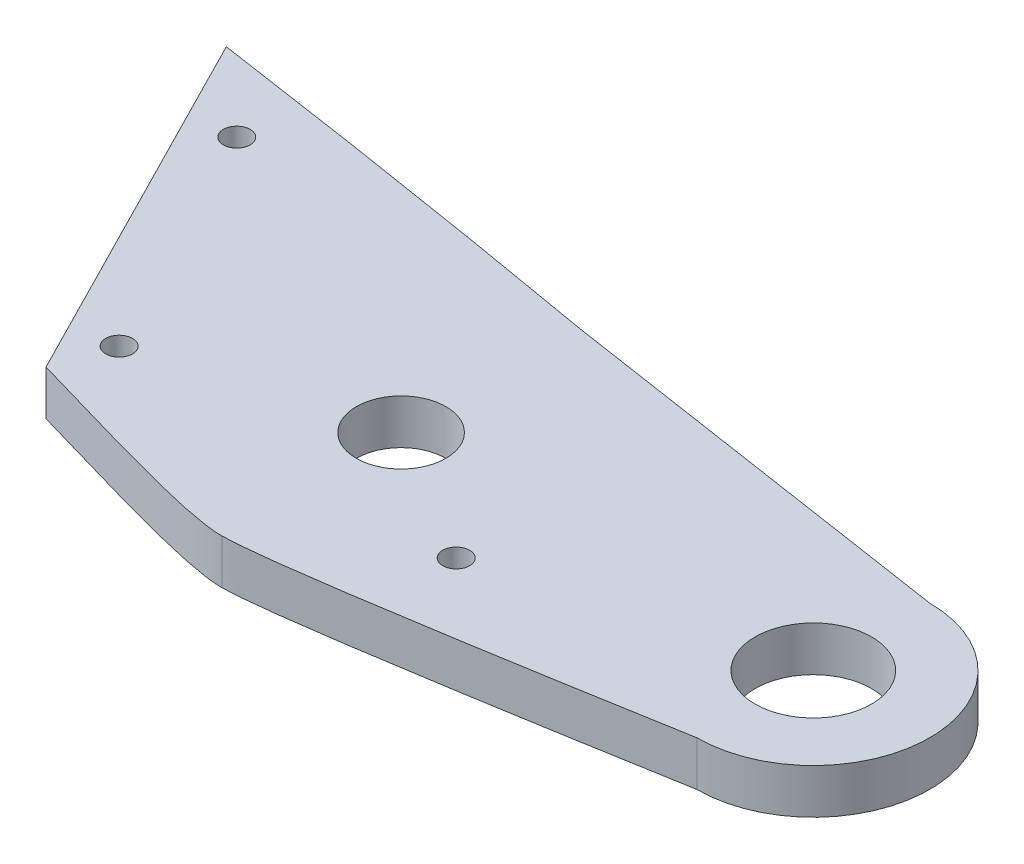
from build123d import *

# Parameters (mm, degrees)
BOSS_EXTRUDE1_DEPTH      = 20
BOSS_EXTRUDE1_DEPTH_BACK = 20
SKETCH1_R                = 5
SKETCH1_R_2              = 6.5
CUT_EXTRUDE4_DEPTH       = 35
SKETCH6_R                = 1.5
CUT_EXTRUDE5_DEPTH       = 10
CUT_EXTRUDE6_DEPTH       = 50


with BuildPart() as part:
    # Sketch1 → Boss-Extrude1 (new, two sides: drawn at the far end of the back side and taken through both)
    with BuildSketch(Plane(origin=(0, 0, 0), x_dir=(1, 0, 0), z_dir=(0, 1, 0)).offset(-BOSS_EXTRUDE1_DEPTH_BACK)):
        with BuildLine():
            ThreePointArc((-328.284271247, 28.284271247), (-328.284271247, -28.284271247), (-271.715728753, -28.284271247))
            add(Edge.make_bspline(
                [(-271.715728753, -28.284271247), (-189.219937614, 54.211519891), (-20, -20), (3.938998468, -20), (19.272331802, -17.666666667), (46, -13)],
                knots=[0, 0, 0, 0, 1, 1, 1.196949923, 1.196949923, 1.196949923, 1.196949923], degree=3))
            ThreePointArc((46, -13), (59, 0), (46, 13))
            add(Edge.make_bspline(
                [(46, 13), (0.03150303, 20), (0, 20)],
                knots=[0.358766717, 0.358766717, 0.358766717, 1.358766717, 1.358766717, 1.358766717], degree=2))
            add(Edge.make_bspline(
                [(0, 20), (-114.873131821, 40.378289836), (-300, 56.568542495), (-328.284271247, 28.284271247)],
                knots=[0.1900067, 0.1900067, 0.1900067, 0.1900067, 1.1900067, 1.1900067, 1.1900067, 1.1900067], degree=3))
        make_face()
        Circle(SKETCH1_R, mode=Mode.SUBTRACT)
        with Locations((46, 0)):
            Circle(SKETCH1_R_2, mode=Mode.SUBTRACT)
    extrude(amount=BOSS_EXTRUDE1_DEPTH + BOSS_EXTRUDE1_DEPTH_BACK)

    # Sketch5 → Cut-Extrude4 (cut)
    with BuildSketch(Plane(origin=(0, 20, 0), x_dir=(1, 0, 0), z_dir=(0, 1, 0))):
        Polygon((-47.037049996, 27.527548523), (92.120786702, 16.164640032), (85.724700256, -16.918764701), (-17.262768022, -30.907770073), align=None)
    extrude(amount=-CUT_EXTRUDE4_DEPTH, mode=Mode.SUBTRACT)

    # Sketch6 → Cut-Extrude5 (cut)
    with BuildSketch(Plane(origin=(0, -20, 0), x_dir=(-1, 0, 0), z_dir=(0, -1, 0))):
        with Locations((24.075864732, -7.392954454)):
            Circle(SKETCH6_R)
        with Locations((-15.201479432, -9.052862087)):
            Circle(SKETCH6_R)
        with Locations((37.713784288, 19.37296974)):
            Circle(SKETCH6_R)
    extrude(amount=-CUT_EXTRUDE5_DEPTH, mode=Mode.SUBTRACT)

    # Sketch7 → Cut-Extrude6 (cut)
    with BuildSketch(Plane(origin=(0, 20, 0), x_dir=(1, 0, 0), z_dir=(0, 1, 0))):
        Polygon((-47.037049996, 27.527548523), (-26.137658318, -13.489817144), (-379.595719096, -92.580220424), (-321.505561991, 137.254748988), align=None)
    extrude(amount=-CUT_EXTRUDE6_DEPTH, mode=Mode.SUBTRACT)


solid = part.part
